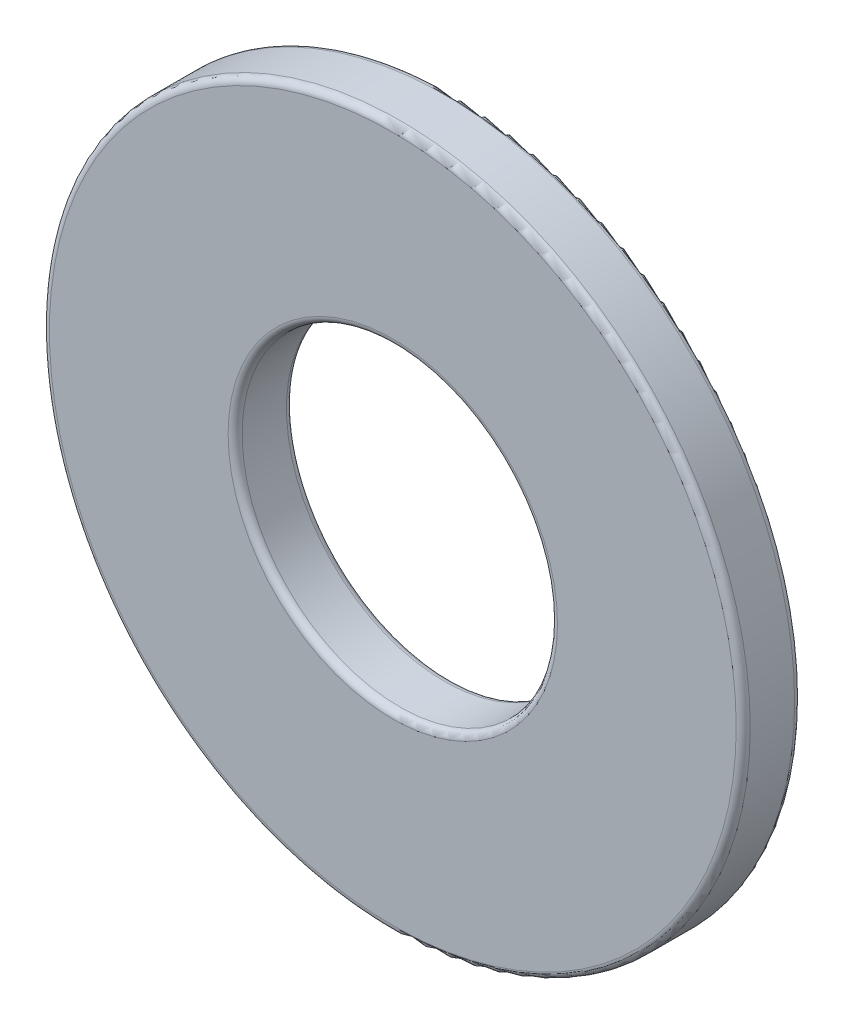
from build123d import *

# Parameters (mm, degrees)
BOSS_EXTRUDE1_START = 0.25
SKETCH3_R           = 3
SKETCH3_R_2         = 1.35
BOSS_EXTRUDE1_DEPTH = 0.5
FILLET1_R           = 0.06


with BuildPart() as part:
    # Sketch3 → Boss-Extrude1 (new body)
    with BuildSketch(Plane.XY.offset(BOSS_EXTRUDE1_START)):
        Circle(SKETCH3_R)
        Circle(SKETCH3_R_2, mode=Mode.SUBTRACT)
    extrude(amount=-BOSS_EXTRUDE1_DEPTH)

    # Fillet1
    fillet1_edges = [part.edges().sort_by_distance(p)[0] for p in [
        (-3, 0, 0.25),
        (-3, 0, -0.25),
        (-1.35, 0, -0.25),
        (-1.35, 0, 0.25),
    ]]
    fillet(fillet1_edges, radius=FILLET1_R)


solid = part.part
